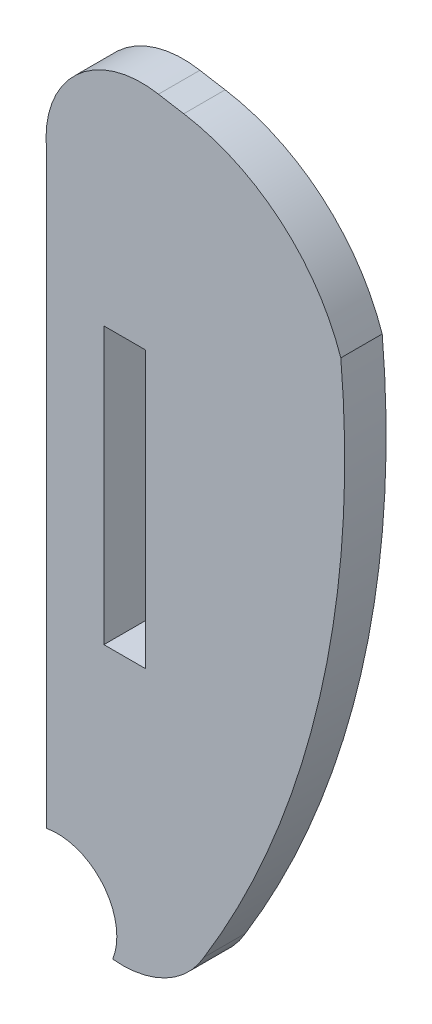
from build123d import *

# Parameters (mm, degrees)
SKETCH1_W          = 3
SKETCH1_H          = 20
BASE_EXTRUDE_DEPTH = 3


with BuildPart() as part:
    # Sketch1 → Base-Extrude (new body)
    with BuildSketch(Plane.XY):
        with BuildLine():
            Line((490.859334316, 48.711445231), (490.859334316, 91.178595635))
            ThreePointArc((490.859334316, 91.178595635), (492.980510735, 97.046258165), (498.958835763, 98.831890501))
            ThreePointArc((498.958835763, 98.831890501), (499.873560394, 98.672316261), (500.789492391, 98.519824725))
            ThreePointArc((500.789492391, 98.519824725), (507.814480551, 95.282897305), (512.167074898, 88.888909486))
            ThreePointArc((512.167074898, 88.888909486), (510.632309562, 66.803543283), (502.248398483, 46.313815613))
            ThreePointArc((502.248398483, 46.313815613), (499.455679175, 43.623308538), (495.646031752, 42.898949534))
            ThreePointArc((495.646031752, 42.898949534), (494.9563895, 47.208231088), (490.859334316, 48.711445231))
        make_face()
        with Locations((496.503228356, 72.313930056)):
            Rectangle(SKETCH1_W, SKETCH1_H, mode=Mode.SUBTRACT)
    extrude(amount=BASE_EXTRUDE_DEPTH)


solid = part.part
